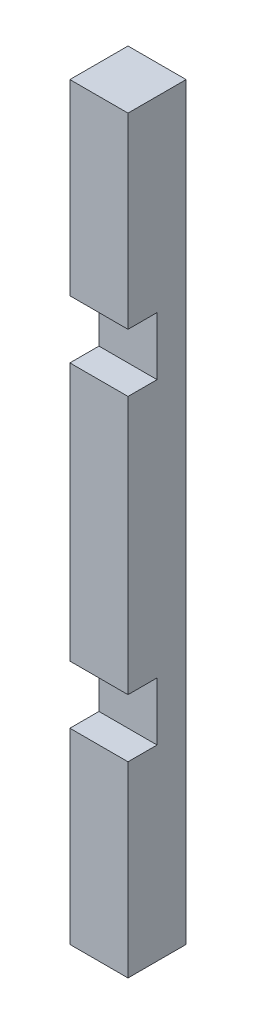
from build123d import *

# Parameters (mm, degrees)
SKETCH1_W           = 90
SKETCH1_H           = 90
BOSS_EXTRUDE1_DEPTH = 1160
SKETCH3_W           = 90
SKETCH3_H           = 90
CUT_EXTRUDE1_DEPTH  = 45
SKETCH4_W           = 90
SKETCH4_H           = 90
CUT_EXTRUDE2_DEPTH  = 45


with BuildPart() as part:
    # Sketch1 → Boss-Extrude1 (new body)
    with BuildSketch(Plane(origin=(0, 0, 0), x_dir=(1, 0, 0), z_dir=(0, 1, 0))):
        with Locations((45, 45)):
            Rectangle(SKETCH1_W, SKETCH1_H)
    extrude(amount=BOSS_EXTRUDE1_DEPTH)

    # Sketch3 → Cut-Extrude1 (cut)
    with BuildSketch(Plane.XY):
        with Locations((45, 825)):
            Rectangle(SKETCH3_W, SKETCH3_H)
    extrude(amount=-CUT_EXTRUDE1_DEPTH, mode=Mode.SUBTRACT)

    # Sketch4 → Cut-Extrude2 (cut)
    with BuildSketch(Plane.XY):
        with Locations((45, 335)):
            Rectangle(SKETCH4_W, SKETCH4_H)
    extrude(amount=-CUT_EXTRUDE2_DEPTH, mode=Mode.SUBTRACT)


solid = part.part
